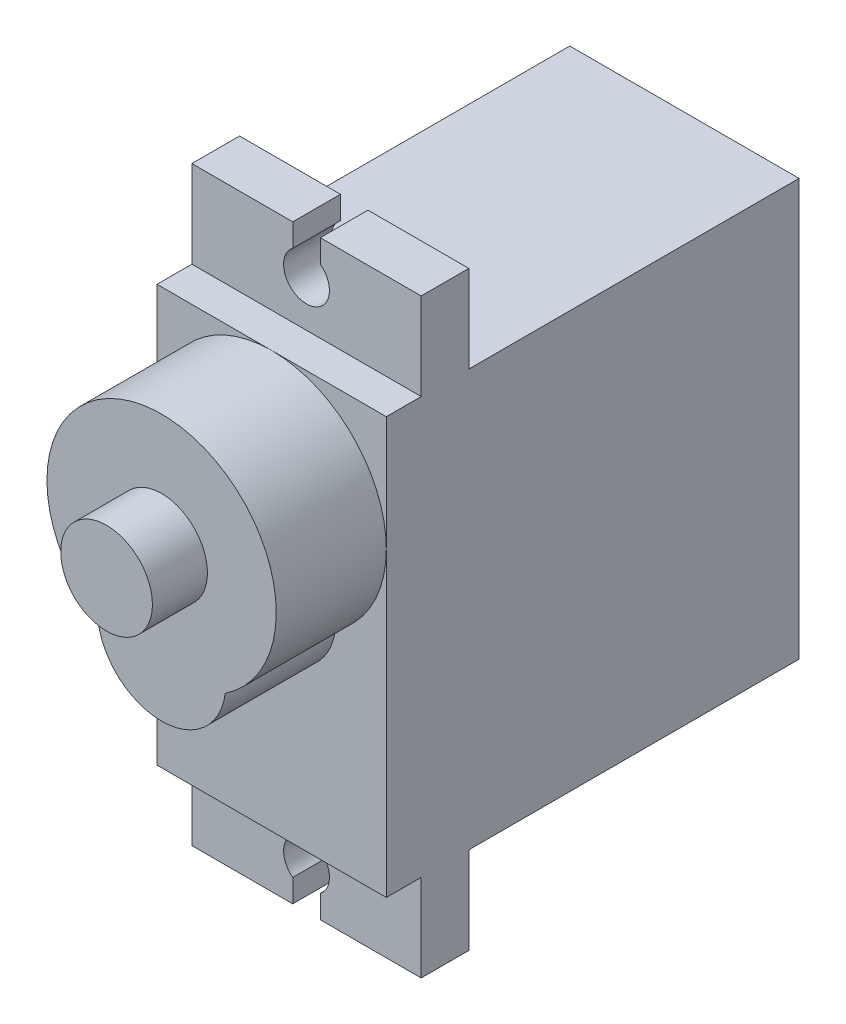
from build123d import *

# Parameters (mm, degrees)
BOSS_EXTRUDE1_DEPTH = 12.5
BOSS_EXTRUDE2_DEPTH = 6
SKETCH4_R           = 2.5
BOSS_EXTRUDE3_DEPTH = 3
SKETCH5_R           = 1.25
CUT_EXTRUDE1_DEPTH  = 2.6


with BuildPart() as part:
    # Sketch2 → Boss-Extrude1 (new body)
    with BuildSketch(Plane.YZ):
        Polygon((0, 0), (0, 18), (-4.75, 18), (-4.75, 20.6), (0, 20.6), (0, 22.5), (22.7, 22.5), (22.7, 20.6), (27.45, 20.6), (27.45, 18), (22.7, 18), (22.7, 0), align=None)
    extrude(amount=BOSS_EXTRUDE1_DEPTH)

    # Sketch3 → Boss-Extrude2 (add)
    with BuildSketch(Plane.XY.offset(22.5)):
        with BuildLine():
            ThreePointArc((2.778708958, 11.252631579), (3.938700525, 9.071712585), (6.25, 8.2))
            Line((6.25, 8.2), (6.25, 10.2))
            ThreePointArc((6.25, 10.2), (4.436309375, 10.468944381), (2.778708958, 11.252631579))
        make_face()
        with BuildLine():
            Line((6.25, 10.2), (6.25, 8.2))
            ThreePointArc((6.25, 8.2), (8.561299475, 9.071712585), (9.721291042, 11.252631579))
            ThreePointArc((9.721291042, 11.252631579), (8.063690625, 10.468944381), (6.25, 10.2))
        make_face()
        with BuildLine():
            ThreePointArc((2.778708958, 11.252631579), (4.436309375, 10.468944381), (6.25, 10.2))
            Line((6.25, 10.2), (6.25, 15.2))
            ThreePointArc((6.25, 15.2), (3.621712585, 14.011299475), (2.778708958, 11.252631579))
        make_face()
        with BuildLine():
            Line((6.25, 15.2), (6.25, 10.2))
            ThreePointArc((6.25, 10.2), (8.063690625, 10.468944381), (9.721291042, 11.252631579))
            ThreePointArc((9.721291042, 11.252631579), (9.742815386, 11.475855678), (9.75, 11.7))
            ThreePointArc((9.75, 11.7), (8.724873734, 14.174873734), (6.25, 15.2))
        make_face()
        with BuildLine():
            ThreePointArc((6.25, 22.7), (0.268944381, 18.263690625), (2.778708958, 11.252631579))
            ThreePointArc((2.778708958, 11.252631579), (3.621712585, 14.011299475), (6.25, 15.2))
            Line((6.25, 15.2), (6.25, 22.7))
        make_face()
        with BuildLine():
            ThreePointArc((9.75, 11.7), (9.742815386, 11.475855678), (9.721291042, 11.252631579))
            ThreePointArc((9.721291042, 11.252631579), (11.761717927, 13.503227953), (12.5, 16.45))
            ThreePointArc((12.5, 16.45), (10.669417382, 20.869417382), (6.25, 22.7))
            Line((6.25, 22.7), (6.25, 15.2))
            ThreePointArc((6.25, 15.2), (8.724873734, 14.174873734), (9.75, 11.7))
        make_face()
    extrude(amount=BOSS_EXTRUDE2_DEPTH)

    # Sketch4 → Boss-Extrude3 (add)
    with BuildSketch(Plane.XY.offset(28.5)):
        with Locations((6.25, 16.45)):
            Circle(SKETCH4_R)
    extrude(amount=BOSS_EXTRUDE3_DEPTH)

    # Sketch5 → Cut-Extrude1 (cut)
    with BuildSketch(Plane.XY.offset(20.6)):
        with BuildLine():
            Line((7, 27.45), (5.5, 27.45))
            Line((5.5, 27.45), (5.5, 26.2))
            ThreePointArc((5.5, 26.2), (6.25, 26.45), (7, 26.2))
            Line((7, 26.2), (7, 27.45))
        make_face()
        with Locations((6.25, 25.2)):
            Circle(SKETCH5_R)
        with BuildLine():
            ThreePointArc((7, -3.5), (6.25, -3.75), (5.5, -3.5))
            Line((5.5, -3.5), (5.5, -4.75))
            Line((5.5, -4.75), (7, -4.75))
            Line((7, -4.75), (7, -3.5))
        make_face()
        with Locations((6.25, -2.5)):
            Circle(SKETCH5_R)
    extrude(amount=-CUT_EXTRUDE1_DEPTH, mode=Mode.SUBTRACT)


solid = part.part
